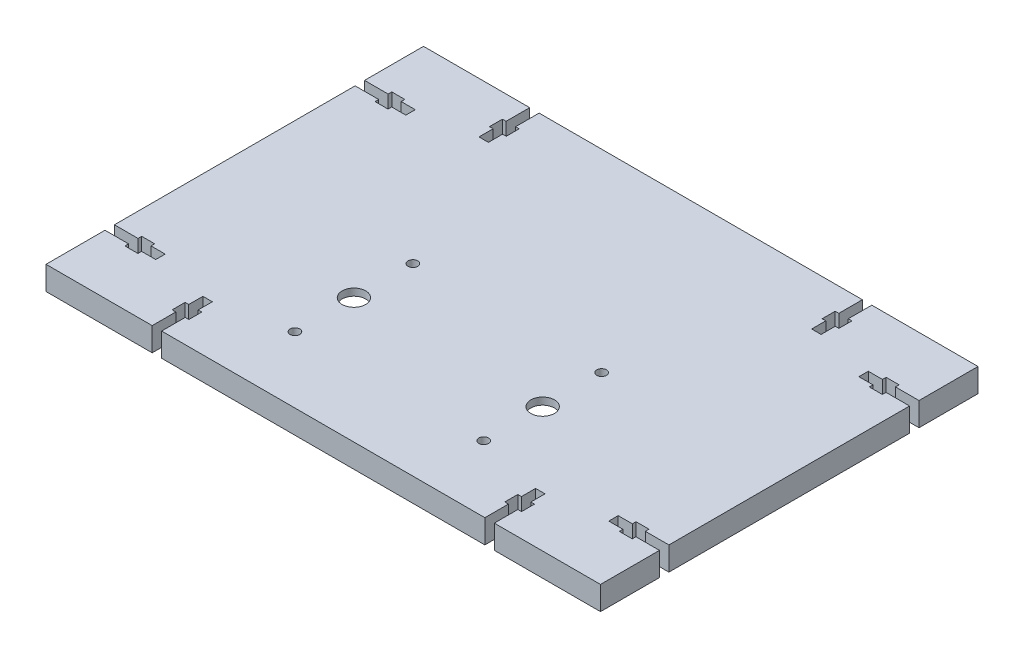
from build123d import *

# Parameters (mm, degrees)
SKETCH1_W               = 235
SKETCH1_H               = 10
BOSS_EXTRUDE1_DEPTH     = 160
CUT_EXTRUDE1_DEPTH      = 7
SKETCH5_R               = 5
CUT_EXTRUDE2_DEPTH      = 33
SKETCH6_R               = 2.05
CUT_EXTRUDE3_DEPTH      = 33
ENL_V_MAT_EXTRU_2_DEPTH = 10
ENL_V_MAT_EXTRU_3_DEPTH = 10


with BuildPart() as part:
    # Sketch1 → Boss-Extrude1 (new body)
    with BuildSketch(Plane.XY):
        with Locations((117.5, 5)):
            Rectangle(SKETCH1_W, SKETCH1_H)
    extrude(amount=BOSS_EXTRUDE1_DEPTH)

    # Sketch3 → Cut-Extrude1 (cut)
    with BuildSketch(Plane.XZ):
        with BuildLine():
            Line((137.5, 132), (137.5, 82))
            ThreePointArc((137.5, 82), (157.5, 62), (177.5, 82))
            Line((177.5, 82), (177.5, 132))
            ThreePointArc((177.5, 132), (157.5, 152), (137.5, 132))
        make_face()
        with BuildLine():
            Line((57.5, 132), (57.5, 82))
            ThreePointArc((57.5, 82), (77.5, 62), (97.5, 82))
            Line((97.5, 82), (97.5, 132))
            ThreePointArc((97.5, 132), (77.5, 152), (57.5, 132))
        make_face()
    extrude(amount=-CUT_EXTRUDE1_DEPTH, mode=Mode.SUBTRACT)

    # Sketch5 → Cut-Extrude2 (cut)
    with BuildSketch(Plane.XZ.offset(-7)):
        with Locations(Location((77.5, 107, 0), (0, 0, 270))):
            Circle(SKETCH5_R)
        with Locations((157.5, 107)):
            Circle(SKETCH5_R)
    extrude(amount=-CUT_EXTRUDE2_DEPTH, mode=Mode.SUBTRACT)

    # Sketch6 → Cut-Extrude3 (cut)
    with BuildSketch(Plane.XZ.offset(-7)):
        with Locations(Location((77.5, 82, 0), (0, 0, 270))):
            Circle(SKETCH6_R)
        with Locations((77.5, 132)):
            Circle(SKETCH6_R)
        with Locations((157.5, 82)):
            Circle(SKETCH6_R)
        with Locations(Location((157.5, 132, 0), (0, 0, 270))):
            Circle(SKETCH6_R)
    extrude(amount=-CUT_EXTRUDE3_DEPTH, mode=Mode.SUBTRACT)

    # Esquisse2 → Enlèv. mat.-Extru.2 (cut)
    with BuildSketch(Plane.XZ):
        Polygon((0, 135), (10, 135), (10, 136.55), (15.5, 136.55), (15.5, 135), (21.5, 135), (21.5, 131), (15.5, 131), (15.5, 129.45), (10, 129.45), (10, 131), (0, 131), align=None)
        Polygon((0, 29), (10, 29), (10, 30.55), (15.5, 30.55), (15.5, 29), (21.5, 29), (21.5, 25), (15.5, 25), (15.5, 23.45), (10, 23.45), (10, 25), (0, 25), align=None)
        Polygon((235, 25), (225, 25), (225, 23.45), (219.5, 23.45), (219.5, 25), (213.5, 25), (213.5, 29), (219.5, 29), (219.5, 30.55), (225, 30.55), (225, 29), (235, 29), align=None)
        Polygon((235, 131), (225, 131), (225, 129.45), (219.5, 129.45), (219.5, 131), (213.5, 131), (213.5, 135), (219.5, 135), (219.5, 136.55), (225, 136.55), (225, 135), (235, 135), align=None)
    extrude(amount=-ENL_V_MAT_EXTRU_2_DEPTH, mode=Mode.SUBTRACT)

    # Esquisse3 → Enlèv. mat.-Extru.3 (cut)
    with BuildSketch(Plane.XZ):
        Polygon((49, 160), (49, 150), (50.55, 150), (50.55, 144.5), (49, 144.5), (49, 138.5), (45, 138.5), (45, 144.5), (43.45, 144.5), (43.45, 150), (45, 150), (45, 160), align=None)
        Polygon((190, 138.5), (186, 138.5), (186, 144.5), (184.45, 144.5), (184.45, 150), (186, 150), (186, 160), (190, 160), (190, 150), (191.55, 150), (191.55, 144.5), (190, 144.5), align=None)
        Polygon((186, 0), (186, 10), (184.45, 10), (184.45, 15.5), (186, 15.5), (186, 21.5), (190, 21.5), (190, 15.5), (191.55, 15.5), (191.55, 10), (190, 10), (190, 0), align=None)
        Polygon((45, 21.5), (49, 21.5), (49, 15.5), (50.55, 15.5), (50.55, 10), (49, 10), (49, 0), (45, 0), (45, 10), (43.45, 10), (43.45, 15.5), (45, 15.5), align=None)
    extrude(amount=-ENL_V_MAT_EXTRU_3_DEPTH, mode=Mode.SUBTRACT)


solid = part.part
